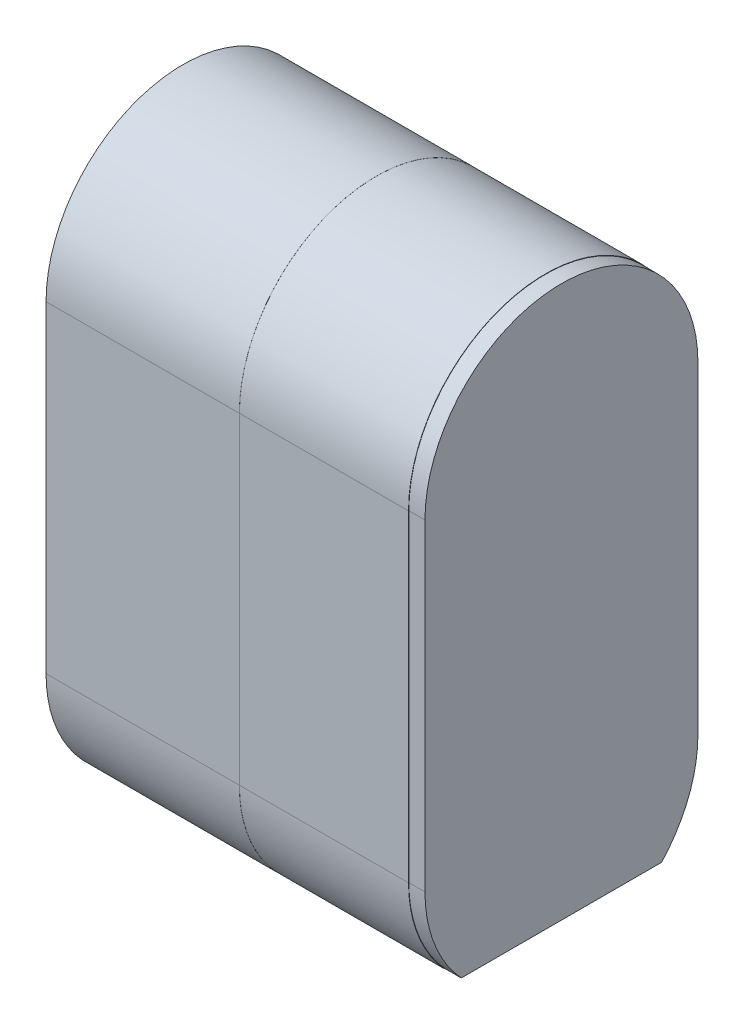
from build123d import *

# Parameters (mm, degrees)
BOSS_EXTRUDE1_DEPTH      = 20
BOSS_EXTRUDE1_DEPTH_BACK = 2
CUT_EXTRUDE3_DEPTH       = 64.419239983
BOSS_EXTRUDE2_START      = 2
BOSS_EXTRUDE2_DEPTH      = 2
SKETCH6_R                = 15
CUT_EXTRUDE4_DEPTH       = 60.32526856
BOSS_EXTRUDE3_DEPTH      = 21
BOSS_EXTRUDE5_DEPTH      = 2


with BuildPart() as part:
    # Sketch1 → Boss-Extrude1 (new, two sides: drawn at the far end of the back side and taken through both)
    with BuildSketch(Plane(origin=(0, 0, 0), x_dir=(0, 0, -1), z_dir=(1, 0, 0)).offset(-BOSS_EXTRUDE1_DEPTH_BACK)):
        with BuildLine():
            Line((17, 0), (17, -40))
            ThreePointArc((17, -40), (0, -57), (-17, -40))
            Line((-17, -40), (-17, 0))
            ThreePointArc((-17, 0), (0, 17), (17, 0))
        make_face()
        with BuildLine():
            Line((15, 0), (15, -40))
            ThreePointArc((15, -40), (0, -55), (-15, -40))
            Line((-15, -40), (-15, 0))
            ThreePointArc((-15, 0), (0, 15), (15, 0))
        make_face(mode=Mode.SUBTRACT)
    extrude(amount=BOSS_EXTRUDE1_DEPTH + BOSS_EXTRUDE1_DEPTH_BACK)

    # Sketch4 → Cut-Extrude3 (cut, through all)
    with BuildSketch(Plane(origin=(20, 0, 0), x_dir=(0, 0, -1), z_dir=(1, 0, 0))):
        with BuildLine():
            ThreePointArc((-9.64115149, -51.491222648), (-10.675198738, -50.537558157), (-11.615364508, -49.491222648))
            Line((-11.615364508, -49.491222648), (-12.5, -49.491222648))
            Line((-12.5, -49.491222648), (-12.5, -51.491222648))
            Line((-12.5, -51.491222648), (-12.5, -51.521718622))
            ThreePointArc((-12.5, -51.521718622), (0, -57), (12.5, -51.521718622))
            Line((12.5, -51.521718622), (12.5, -51.491222648))
            Line((12.5, -51.491222648), (12.5, -49.491222648))
            Line((12.5, -49.491222648), (11.615364508, -49.491222648))
            ThreePointArc((11.615364508, -49.491222648), (1.405126065, -54.934042344), (-9.64115149, -51.491222648))
        make_face()
    extrude(amount=-CUT_EXTRUDE3_DEPTH, mode=Mode.SUBTRACT)

    # Sketch5 → Boss-Extrude2 (add)
    with BuildSketch(Plane.ZY.offset(2).offset(BOSS_EXTRUDE2_START)):
        with BuildLine():
            Line((17, 0), (17, -40))
            ThreePointArc((17, -40), (15.835087622, -46.184658438), (12.5, -51.521718622))
            Line((12.5, -51.521718622), (-12.5, -51.521718622))
            ThreePointArc((-12.5, -51.521718622), (-15.835087622, -46.184658438), (-17, -40))
            Line((-17, -40), (-17, 0))
            ThreePointArc((-17, 0), (0, 17), (17, 0))
        make_face()
    extrude(amount=-BOSS_EXTRUDE2_DEPTH)

    # Sketch6 → Cut-Extrude4 (cut, through all)
    with BuildSketch(Plane.ZY.offset(4)):
        with Locations((-0.05, -8.091222648)):
            Circle(SKETCH6_R)
    extrude(amount=-CUT_EXTRUDE4_DEPTH, mode=Mode.SUBTRACT)


with BuildPart() as body_2:
    # Sketch7 → Boss-Extrude3 (new body)
    with BuildSketch(Plane(origin=(20, 0, 0), x_dir=(0, 0, -1), z_dir=(1, 0, 0))):
        with BuildLine():
            Line((-12.5, -51.509017495), (-12.5, -49.491222648))
            Line((-12.5, -49.491222648), (-11.615364508, -49.491222648))
            ThreePointArc((-11.615364508, -49.491222648), (-14.128525536, -45.038329703), (-15, -40))
            Line((-15, -40), (-15, -38.389225494))
            Line((-15, -38.389225494), (-15.099585299, 0))
            ThreePointArc((-15.099585299, 0), (0, 15.099585299), (15.099585299, 0))
            Line((15.099585299, 0), (15, -38.389225494))
            Line((15, -38.389225494), (15, -40))
            ThreePointArc((15, -40), (14.128525536, -45.038329703), (11.615364508, -49.491222648))
            Line((11.615364508, -49.491222648), (12.5, -49.491222648))
            Line((12.5, -49.491222648), (12.5, -51.509017495))
            ThreePointArc((12.5, -51.509017495), (15.82876991, -46.177177903), (16.991394401, -40))
            Line((16.991394401, -40), (16.991394401, 0))
            ThreePointArc((16.991394401, 0), (0, 16.991394401), (-16.991394401, 0))
            Line((-16.991394401, 0), (-16.991394401, -40))
            ThreePointArc((-16.991394401, -40), (-15.82876991, -46.177177903), (-12.5, -51.509017495))
        make_face()
    extrude(amount=BOSS_EXTRUDE3_DEPTH)

    # Sketch10 → Boss-Extrude5 (add)
    with BuildSketch(Plane(origin=(41, 0, 0), x_dir=(0, 0, -1), z_dir=(1, 0, 0))):
        with BuildLine():
            Line((-16.947994575, -40), (-16.947994575, 0))
            ThreePointArc((-16.947994575, 0), (0, 16.947994575), (16.947994575, 0))
            Line((16.947994575, 0), (16.947994575, -40))
            ThreePointArc((16.947994575, -40), (15.781057263, -46.180028461), (12.440941943, -51.509017495))
            Line((12.440941943, -51.509017495), (-12.440941943, -51.509017495))
            ThreePointArc((-12.440941943, -51.509017495), (-15.781057263, -46.180028461), (-16.947994575, -40))
        make_face()
    extrude(amount=BOSS_EXTRUDE5_DEPTH)


solid = Compound([part.part, body_2.part])
